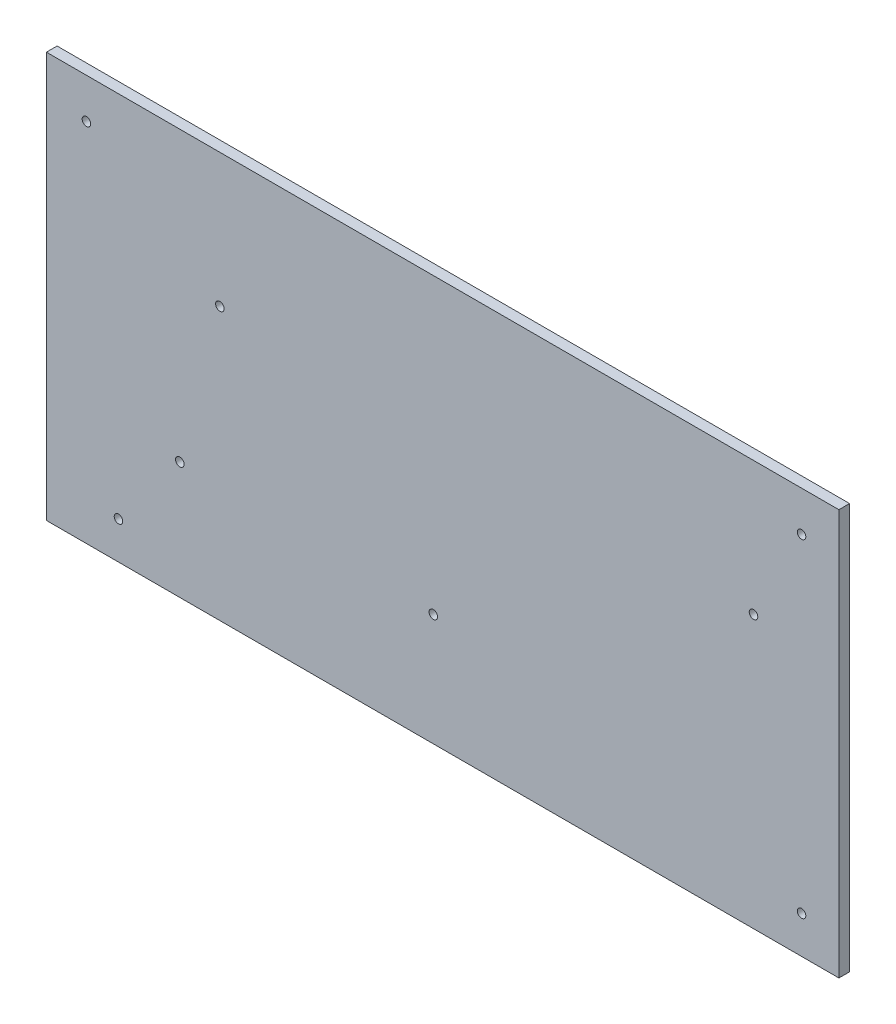
from build123d import *

# Parameters (mm, degrees)
SKETCH_1_W      = 297
SKETCH_1_H      = 152
SKETCH_1_R      = 1.6
EXTRUDE_1_DEPTH = 2


with BuildPart() as part:
    # 草图1 → 凸台-拉伸1 (new, symmetric)
    with BuildSketch(Plane.XY):
        with Locations((3.5, 34)):
            Rectangle(SKETCH_1_W, SKETCH_1_H)
        Circle(SKETCH_1_R, mode=Mode.SUBTRACT)
        with Locations((-80, 60)):
            Circle(SKETCH_1_R, mode=Mode.SUBTRACT)
        with Locations((120, 60)):
            Circle(SKETCH_1_R, mode=Mode.SUBTRACT)
        with Locations((-95, 2)):
            Circle(SKETCH_1_R, mode=Mode.SUBTRACT)
        with Locations((-118, -28)):
            Circle(SKETCH_1_R, mode=Mode.SUBTRACT)
        with Locations((138, -28)):
            Circle(SKETCH_1_R, mode=Mode.SUBTRACT)
        with Locations((-130, 95)):
            Circle(SKETCH_1_R, mode=Mode.SUBTRACT)
        with Locations((138, 95)):
            Circle(SKETCH_1_R, mode=Mode.SUBTRACT)
    extrude(amount=EXTRUDE_1_DEPTH, both=True)


solid = part.part
